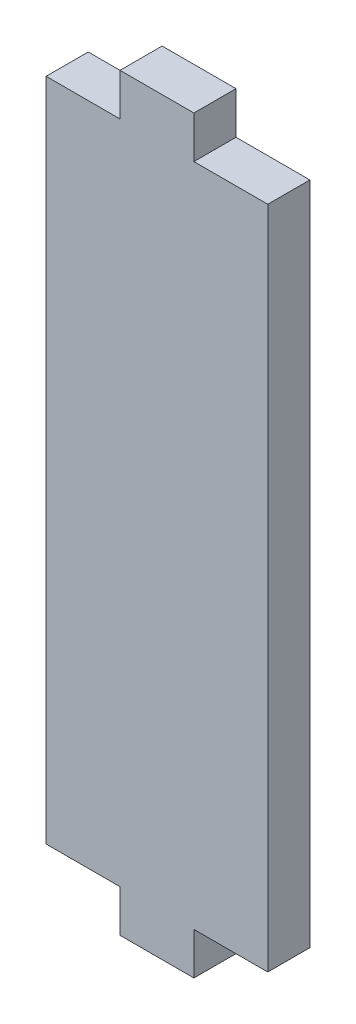
from build123d import *

# Parameters (mm, degrees)
SKETCH1_W           = 25.4
SKETCH1_H           = 85.852
BOSS_EXTRUDE1_DEPTH = 4.826
SKETCH2_W           = 8.466666667
SKETCH2_H           = 4.826
CUT_EXTRUDE1_DEPTH  = 90.660560895


with BuildPart() as part:
    # Sketch1 → Boss-Extrude1 (new body)
    with BuildSketch(Plane.XY):
        with Locations((12.7, 42.926)):
            Rectangle(SKETCH1_W, SKETCH1_H)
    extrude(amount=BOSS_EXTRUDE1_DEPTH)

    # Sketch2 → Cut-Extrude1 (cut, through all)
    with BuildSketch(Plane.XY.offset(4.826)):
        with Locations((4.233333334, 2.413)):
            Rectangle(SKETCH2_W, SKETCH2_H)
        with Locations((21.166666666, 2.413)):
            Rectangle(SKETCH2_W, SKETCH2_H)
        with Locations((21.166666666, 83.439)):
            Rectangle(SKETCH2_W, SKETCH2_H)
        with Locations((4.233333334, 83.439)):
            Rectangle(SKETCH2_W, SKETCH2_H)
    extrude(amount=-CUT_EXTRUDE1_DEPTH, mode=Mode.SUBTRACT)


solid = part.part
